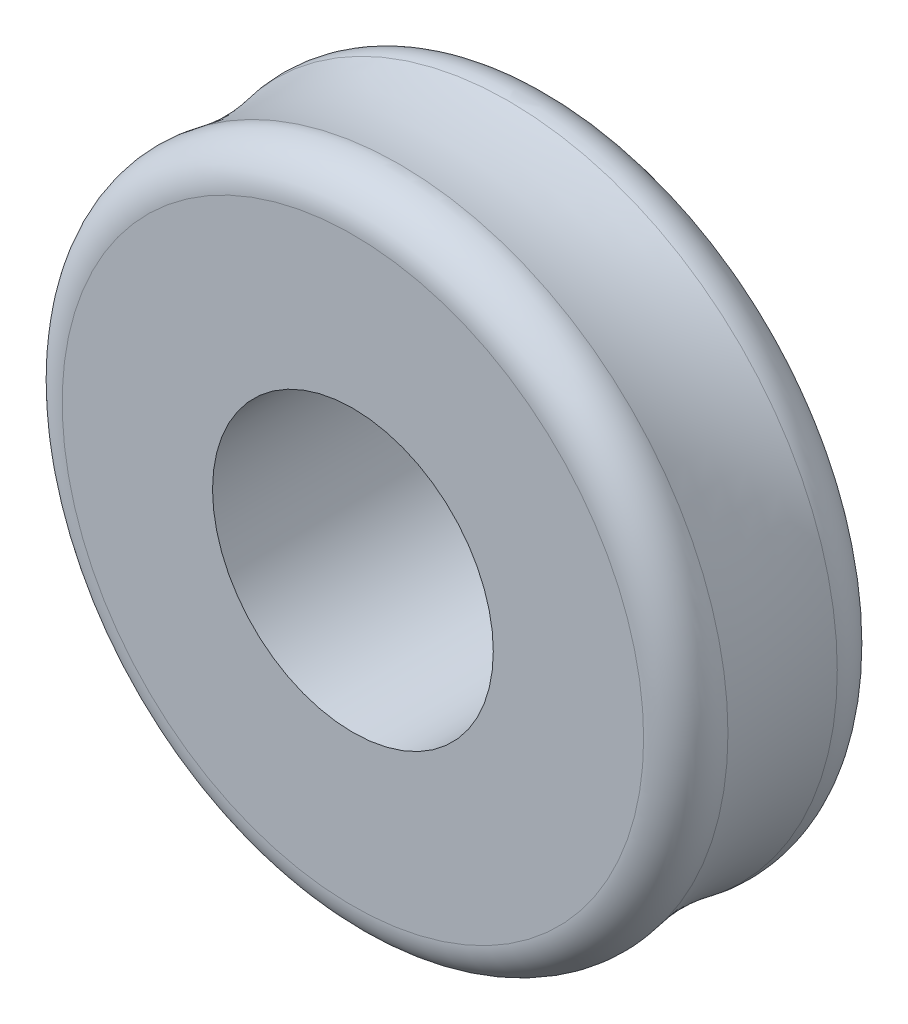
from build123d import *

# Parameters (mm, degrees)
SKETCH1_R           = 4.4323
SKETCH1_R_2         = 1.8161
BOSS_EXTRUDE1_DEPTH = 2.6162
FILLET1_R           = 0.5


with BuildPart() as part:
    # Sketch1 → Boss-Extrude1 (new body)
    with BuildSketch(Plane.XY):
        Circle(SKETCH1_R)
        Circle(SKETCH1_R_2, mode=Mode.SUBTRACT)
    extrude(amount=BOSS_EXTRUDE1_DEPTH)

    # Sketch2 → Cut-Revolve1 (revolve, cut)
    with BuildSketch(Plane(origin=(0, 0, 0), x_dir=(0, 0, -1), z_dir=(1, 0, 0)), mode=Mode.PRIVATE) as cut_revolve1_sk:
        with BuildLine():
            Line((-2.6162, 4.4323), (0, 4.4323))
            ThreePointArc((0, 4.4323), (-1.3081, 4.178663256), (-2.6162, 4.4323))
        make_face()
    revolve(cut_revolve1_sk.sketch.rotate(Axis((0, 0, 2.6162), (0, 0, -1)), 90), axis=Axis((0, 0, 2.6162), (0, 0, -1)), mode=Mode.SUBTRACT)

    # Fillet1
    fillet1_edges = [part.edges().sort_by_distance(p)[0] for p in [
        (-4.4323, 0, 2.6162),
        (-4.4323, 0, 0),
    ]]
    fillet(fillet1_edges, radius=FILLET1_R)


solid = part.part
